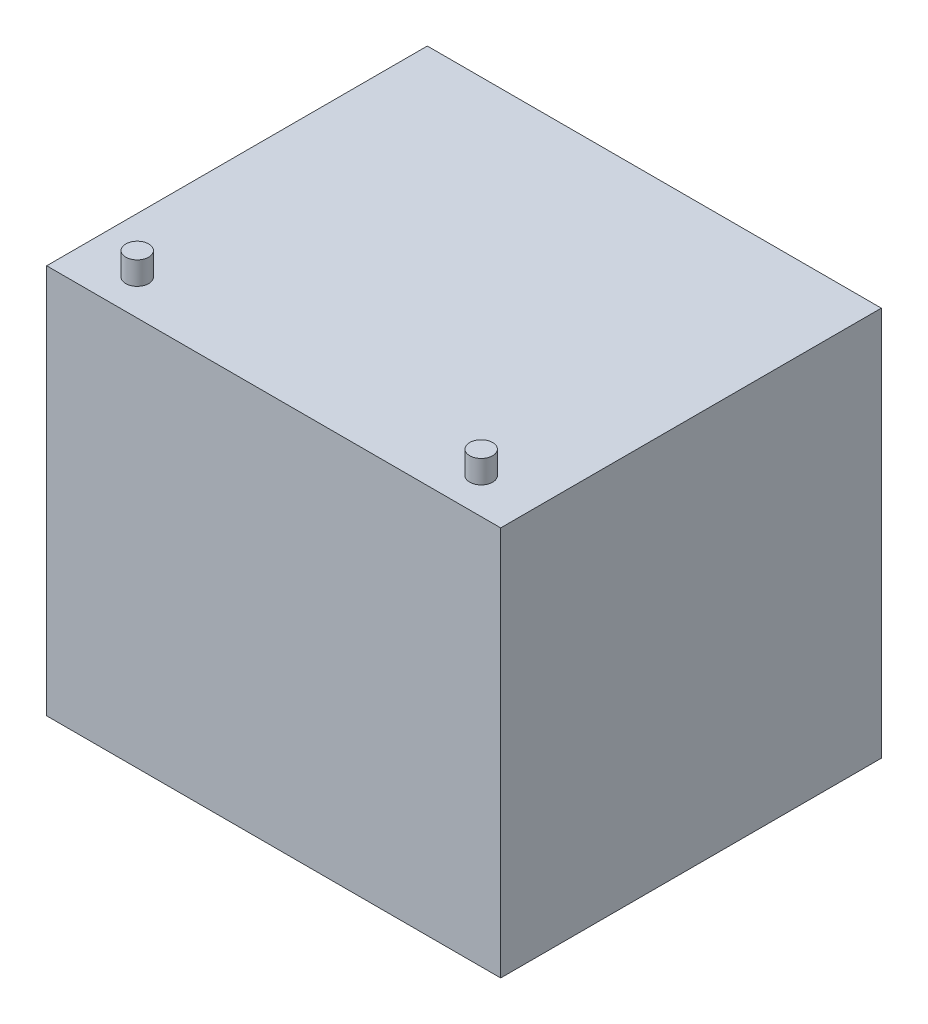
from build123d import *

# Parameters (mm, degrees)
SKETCH1_W           = 198
SKETCH1_H           = 166
BOSS_EXTRUDE1_DEPTH = 170
SKETCH2_R           = 5
BOSS_EXTRUDE2_DEPTH = 10


with BuildPart() as part:
    # Sketch1 → Boss-Extrude1 (new body)
    with BuildSketch(Plane(origin=(0, 0, 0), x_dir=(1, 0, 0), z_dir=(0, 1, 0))):
        Rectangle(SKETCH1_W, SKETCH1_H)
    extrude(amount=BOSS_EXTRUDE1_DEPTH)

    # Sketch2 → Boss-Extrude2 (add)
    with BuildSketch(Plane(origin=(0, 170, 0), x_dir=(1, 0, 0), z_dir=(0, 1, 0))):
        with Locations(Location((-75, -67.5, 0), (0, 0, 270))):
            Circle(SKETCH2_R)
        with Locations(Location((75, -67.5, 0), (0, 0, 270))):
            Circle(SKETCH2_R)
    extrude(amount=BOSS_EXTRUDE2_DEPTH)


solid = part.part
